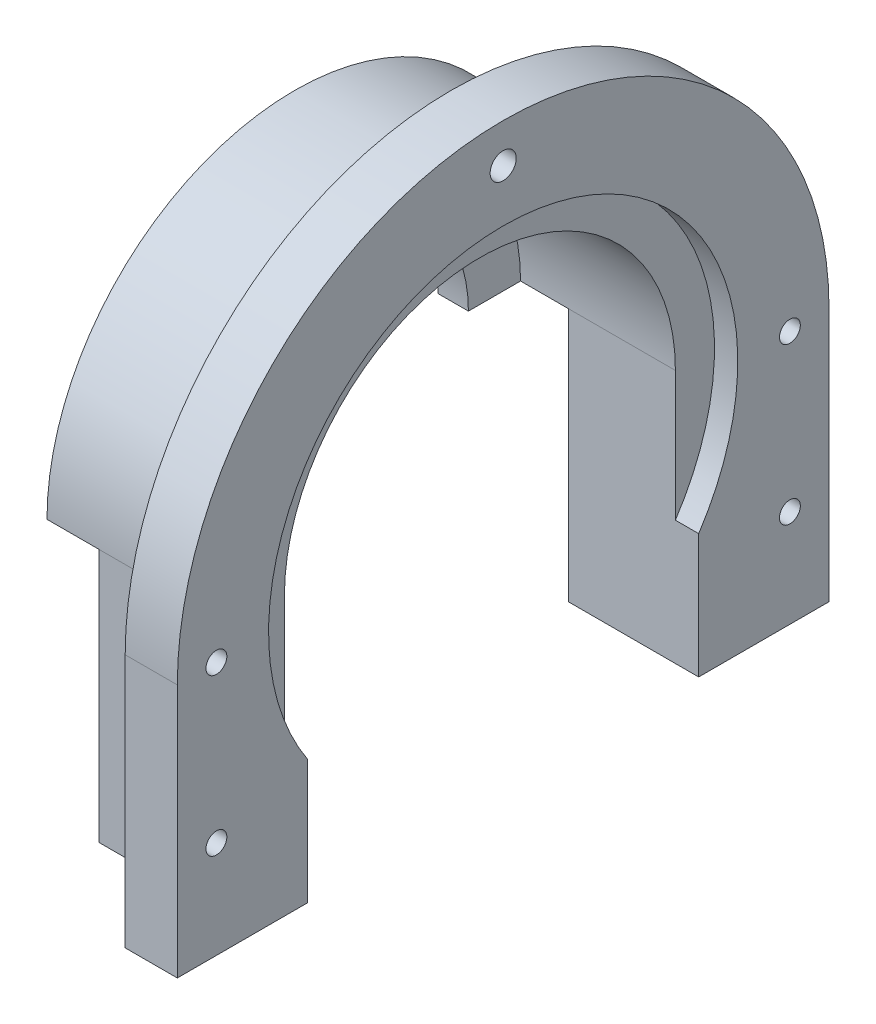
from build123d import *

# Parameters (mm, degrees)
BOSS_EXTRUDE1_DEPTH = 10
BOSS_EXTRUDE2_DEPTH = 20
SKETCH3_W           = 20
SKETCH3_H           = 10
SKETCH3_W_2         = 15
BOSS_EXTRUDE3_DEPTH = 48.687175822
SKETCH4_R           = 2
SKETCH4_R_2         = 2.5
BOSS_EXTRUDE4_DEPTH = 10
CUT_EXTRUDE1_START  = -4.165511
CUT_EXTRUDE1_DEPTH  = 4.165511
SKETCH8_R           = 45
SKETCH8_R_2         = 36
CUT_EXTRUDE2_DEPTH  = 4.465511


with BuildPart() as part:
    # Sketch1 → Boss-Extrude1 (new body)
    with BuildSketch(Plane(origin=(0, 0, 0), x_dir=(0, 0, -1), z_dir=(1, 0, 0))):
        with BuildLine():
            Line((-47.5, 0), (-27.5, 0))
            ThreePointArc((-27.5, 0), (0, 27.5), (27.5, 0))
            Line((27.5, 0), (47.5, 0))
            ThreePointArc((47.5, 0), (0, 47.5), (-47.5, 0))
        make_face()
    extrude(amount=BOSS_EXTRUDE1_DEPTH)

    # Sketch2 → Boss-Extrude2 (add)
    with BuildSketch(Plane(origin=(10, 0, 0), x_dir=(0, 0, -1), z_dir=(1, 0, 0))):
        with BuildLine():
            Line((-47.5, 0), (-37.5, 0))
            ThreePointArc((-37.5, 0), (0, 37.5), (37.5, 0))
            Line((37.5, 0), (47.5, 0))
            ThreePointArc((47.5, 0), (0, 47.5), (-47.5, 0))
        make_face()
    extrude(amount=BOSS_EXTRUDE2_DEPTH)

    # Sketch3 → Boss-Extrude3 (add)
    with BuildSketch(Plane.XZ):
        with Locations((20, 42.5)):
            Rectangle(SKETCH3_W, SKETCH3_H)
        with Locations((22.5, -42.5)):
            Rectangle(SKETCH3_W_2, SKETCH3_H)
    extrude(amount=BOSS_EXTRUDE3_DEPTH)

    # Sketch4 → Boss-Extrude4 (add)
    with BuildSketch(Plane(origin=(30, 0, 0), x_dir=(0, 0, -1), z_dir=(1, 0, 0))):
        with BuildLine():
            Line((62.5, -48.687175822), (37.5, -48.687175822))
            Line((37.5, -48.687175822), (37.5, 0))
            ThreePointArc((37.5, 0), (0, 37.5), (-37.5, 0))
            Line((-37.5, 0), (-37.5, -48.687175822))
            Line((-37.5, -48.687175822), (-62.5, -48.687175822))
            Line((-62.5, -48.687175822), (-62.5, 0))
            ThreePointArc((-62.5, 0), (0, 62.5), (62.5, 0))
            Line((62.5, 0), (62.5, -48.687175822))
        make_face()
        with Locations((-55, 0)):
            Circle(SKETCH4_R, mode=Mode.SUBTRACT)
        with Locations((0, 55)):
            Circle(SKETCH4_R_2, mode=Mode.SUBTRACT)
        with Locations((-55, -30)):
            Circle(SKETCH4_R, mode=Mode.SUBTRACT)
        with Locations(Location((55, -30, 0), (0, 0, 180))):
            Circle(SKETCH4_R, mode=Mode.SUBTRACT)
        with Locations(Location((55, 0, 0), (0, 0, 180))):
            Circle(SKETCH4_R, mode=Mode.SUBTRACT)
    extrude(amount=BOSS_EXTRUDE4_DEPTH)

    # Sketch7 → Cut-Extrude1 (cut)
    with BuildSketch(Plane(origin=(10, 0, 0), x_dir=(0, 0, -1), z_dir=(1, 0, 0)).offset(CUT_EXTRUDE1_START)):
        with BuildLine():
            Line((27.5, 0), (37.5, 0))
            ThreePointArc((37.5, 0), (0, 37.5), (-37.5, 0))
            Line((-37.5, 0), (-27.5, 0))
            ThreePointArc((-27.5, 0), (0, 27.5), (27.5, 0))
        make_face()
    extrude(amount=CUT_EXTRUDE1_DEPTH, mode=Mode.SUBTRACT)

    # Sketch8 → Cut-Extrude2 (cut)
    with BuildSketch(Plane.ZY.offset(-40)):
        Circle(SKETCH8_R)
        Circle(SKETCH8_R_2, mode=Mode.SUBTRACT)
    extrude(amount=CUT_EXTRUDE2_DEPTH, mode=Mode.SUBTRACT)


solid = part.part
